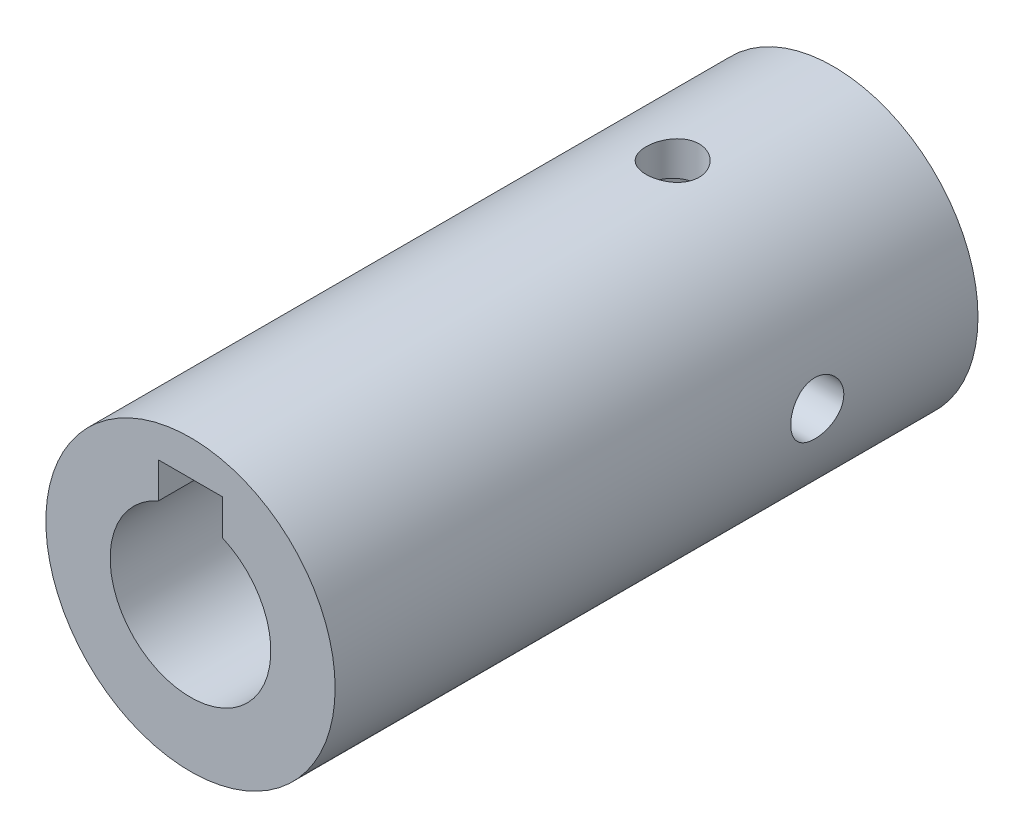
from build123d import *

# Parameters (mm, degrees)
SKETCH_1_R               = 9
SKETCH_1_R_2             = 5
EXTRUDE_1_DEPTH          = 40
SKETCH_2_W               = 4
SKETCH_2_H               = 3.302981626
CUT_EXTRUDE_2_DEPTH      = 42.976183724
SKETCH_3_W               = 1.65
SKETCH_3_H               = 9
PATTERN_CIRCULAR_1_COUNT = 2
PATTERN_CIRCULAR_1_ANGLE = 90


with BuildPart() as part:
    # 草图1 → 拉伸1 (new body)
    with BuildSketch(Plane.XY):
        Circle(SKETCH_1_R)
        Circle(SKETCH_1_R_2, mode=Mode.SUBTRACT)
    extrude(amount=EXTRUDE_1_DEPTH)

    # 草图2 → 拉伸2 (cut, through all)
    with BuildSketch(Plane.XY.offset(40)):
        with Locations((0, 5.148509187)):
            Rectangle(SKETCH_2_W, SKETCH_2_H)
    extrude(amount=-CUT_EXTRUDE_2_DEPTH, mode=Mode.SUBTRACT)

    # 草图3 → M4 螺纹孔2 (revolve, cut)
    with BuildSketch(Plane(origin=(0, 0, 10), x_dir=(0, 0, -1), z_dir=(1, 0, 0))):
        with Locations((0.825, 4.5)):
            Rectangle(SKETCH_3_W, SKETCH_3_H)
    hole_wizard_m4_2 = revolve(axis=Axis((0, -6.35, 10), (0, 1, 0)), mode=Mode.SUBTRACT)

    # 阵列(圆周)1: M4 螺纹孔2 ×2 about axis
    pattern_circular_1_axis = Axis((0, 0, 40), (0, 0, -1))
    for i in range(1, PATTERN_CIRCULAR_1_COUNT):
        add(hole_wizard_m4_2.rotate(pattern_circular_1_axis, i * PATTERN_CIRCULAR_1_ANGLE / (PATTERN_CIRCULAR_1_COUNT - 1)), mode=Mode.SUBTRACT)


solid = part.part
